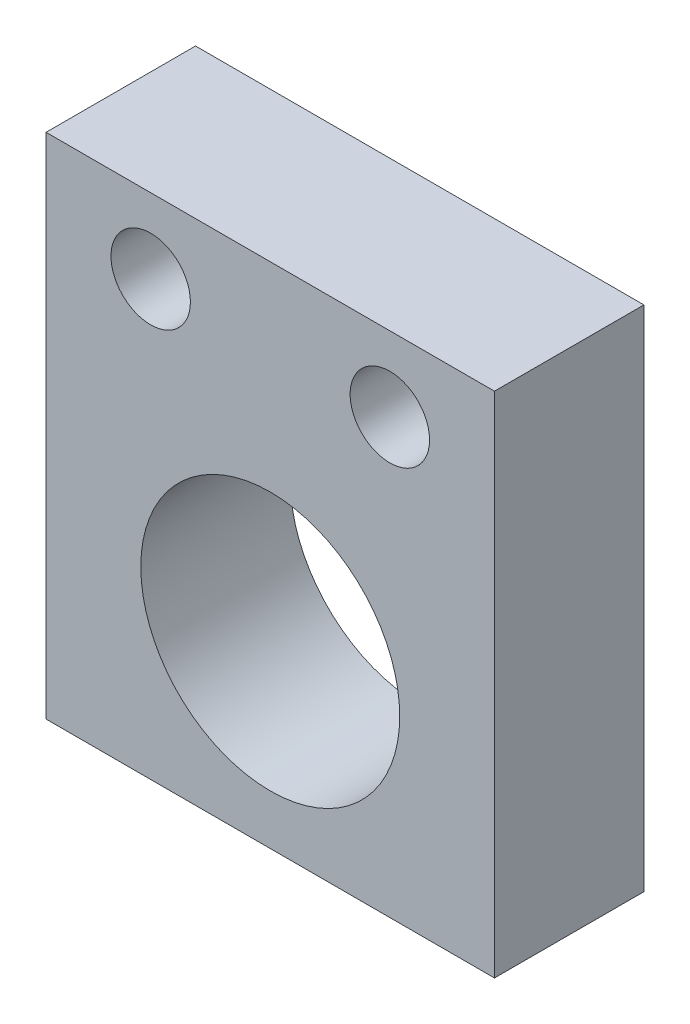
from build123d import *

# Parameters (mm, degrees)
SKETCH1_W                        = 38.1
SKETCH1_H                        = 43.18
BOSS_EXTRUDE1_DEPTH              = 12.7
SKETCH3_R                        = 11
CUT_EXTRUDE1_DEPTH               = 59.969588773
F_17_64_0_26563_DIAMETER_HOLE1_D = 6.747002


with BuildPart() as part:
    # Sketch1 → Boss-Extrude1 (new body)
    with BuildSketch(Plane.XY):
        with Locations((19.05, 21.59)):
            Rectangle(SKETCH1_W, SKETCH1_H)
    extrude(amount=-BOSS_EXTRUDE1_DEPTH)

    # Sketch3 → Cut-Extrude1 (cut, through all)
    with BuildSketch(Plane.XY):
        with Locations((19.05, 15.24)):
            Circle(SKETCH3_R)
    extrude(amount=-CUT_EXTRUDE1_DEPTH, mode=Mode.SUBTRACT)

    # 17/64 (0.26563) Diameter Hole1 (through all)
    with Locations(Plane(origin=(29.21, 36.83, 0), x_dir=(1, 0, 0), z_dir=(0, 0, 1))):
        with Locations((0, 0), (-20.32, 0)):
            Hole(F_17_64_0_26563_DIAMETER_HOLE1_D / 2)


solid = part.part
